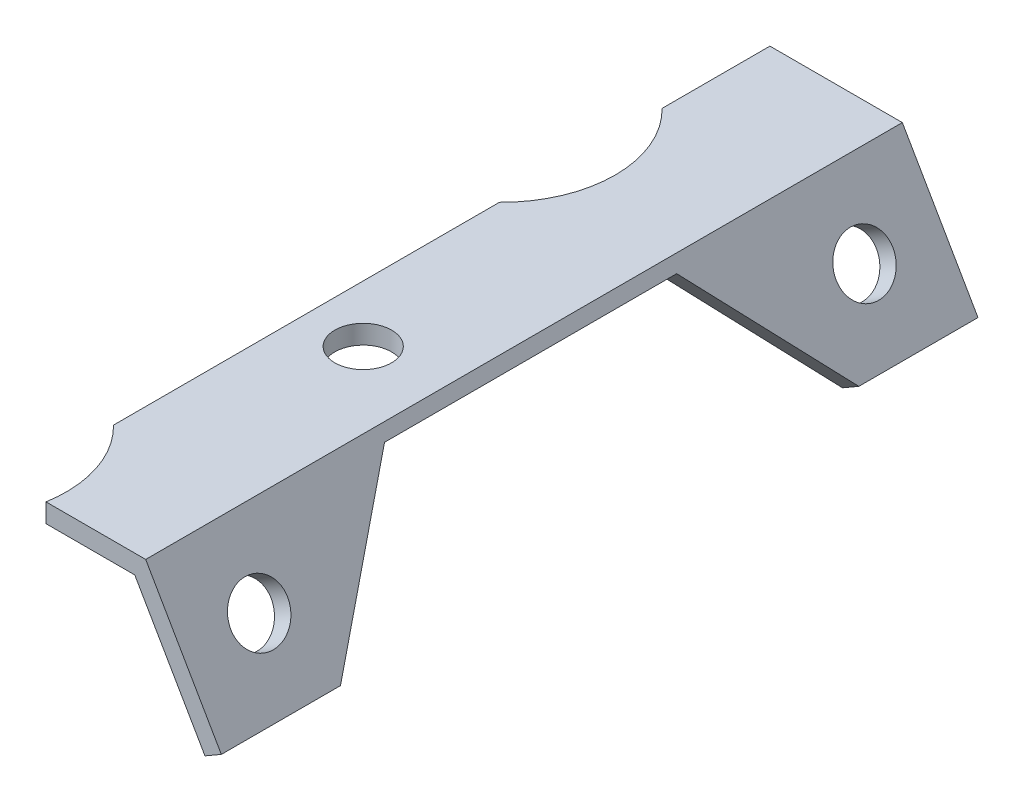
from build123d import *

# Parameters (mm, degrees)
BOSS_EXTRUDE1_DEPTH = 40
SKETCH3_R           = 1.5
CUT_EXTRUDE2_DEPTH  = 1
SKETCH4_R           = 1.5
SKETCH4_R_2         = 6
CUT_EXTRUDE3_DEPTH  = 10


with BuildPart() as part:
    # Sketch1 → Boss-Extrude1 (new body)
    with BuildSketch(Plane.XY):
        Polygon((0, 13), (0, 14), (7, 14), (11, 7.07179677), (10.133974596, 6.57179677), (6.422649731, 13), (1, 13), align=None)
    extrude(amount=BOSS_EXTRUDE1_DEPTH)

    # Sketch3 → Cut-Extrude2 (cut)
    with BuildSketch(Plane(origin=(11.312177826, 6.531088913, 0), x_dir=(0, 0, -1), z_dir=(0.8660254037844402, 0.4999999999999976, 0))):
        with Locations(Location((-36, 4.624355653, 0), (0, 0, 90))):
            Circle(SKETCH3_R)
        with Locations(Location((-4, 4.624355653, 0), (0, 0, 90))):
            Circle(SKETCH3_R)
        Polygon((-33.701530723, 0.624355653), (-27.721710311, 7.927360795), (-12.278289689, 7.927360795), (-6.298469277, 0.624355653), align=None)
    extrude(amount=-CUT_EXTRUDE2_DEPTH, mode=Mode.SUBTRACT)

    # Sketch4 → Cut-Extrude3 (cut)
    with BuildSketch(Plane(origin=(0, 14, 0), x_dir=(-1, 0, 0), z_dir=(0, 1, 0))):
        with Locations(Location((-3, 24.5, 0), (0, 0, 90))):
            Circle(SKETCH4_R)
        with Locations((4.185654705, 10)):
            Circle(SKETCH4_R_2)
        with Locations((4.185654705, 39)):
            Circle(SKETCH4_R_2)
    extrude(amount=-CUT_EXTRUDE3_DEPTH, mode=Mode.SUBTRACT)


solid = part.part
